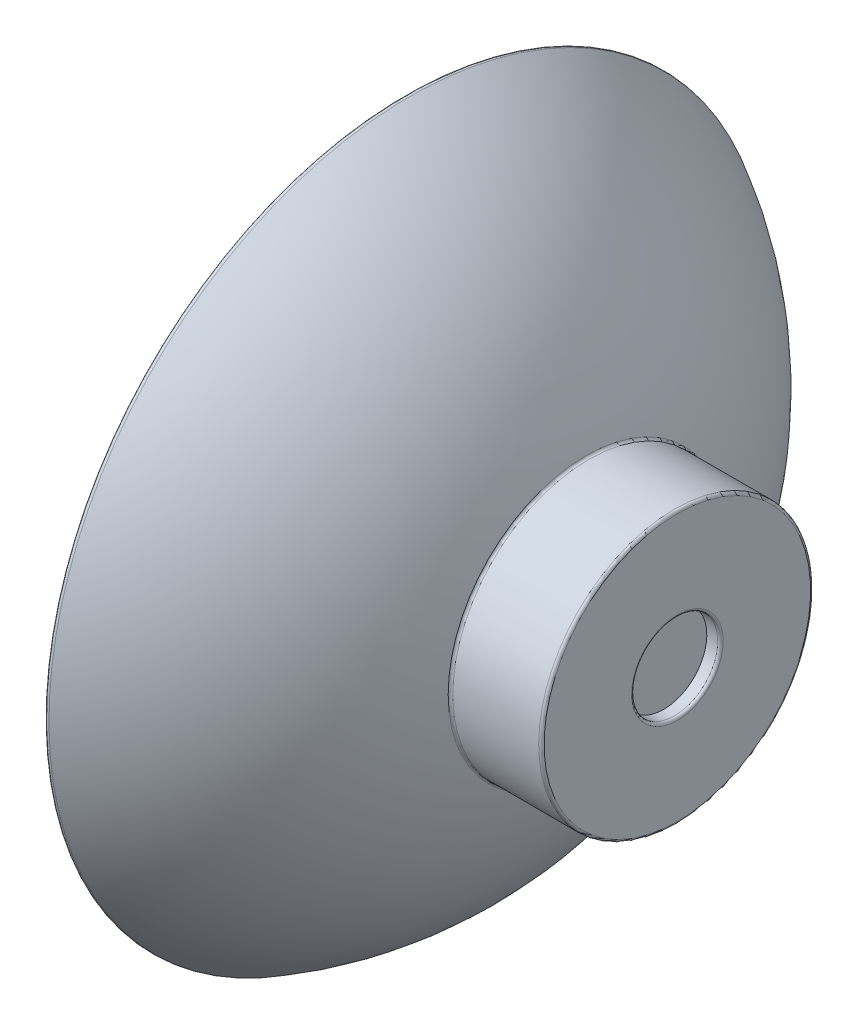
from build123d import *

# Parameters (mm, degrees)
SKETCH2_R          = 2.375
CUT_EXTRUDE2_DEPTH = 0.75
FILLET1_R          = 0.15
FILLET2_R          = 0.15


with BuildPart() as part:
    # Sketch1 → Revolve3 (revolve)
    with BuildSketch(Plane.XY):
        with BuildLine():
            ThreePointArc((-10, 18.822019344), (-3.426328164, 12.472721845), (0, 4))
            Line((0, 4), (0, 7.5))
            ThreePointArc((0, 7.5), (-3.694854211, 14.794116631), (-10, 20))
            Line((-10, 20), (-10, 18.822019344))
        make_face()
        Polygon((0, 4), (0, 0), (2, 0), (2, 4.75), (4, 4.75), (4, 0), (5, 0), (5, 7.5), (0, 7.5), align=None)
    revolve(axis=Axis((0, 0, 0), (-1, 0, 0)))

    # Sketch2 → Cut-Extrude2 (cut)
    with BuildSketch(Plane(origin=(5, 0, 0), x_dir=(0, 0, -1), z_dir=(1, 0, 0))):
        with Locations(Location((0, 0, 0), (0, 0, 90))):
            Circle(SKETCH2_R)
    extrude(amount=-CUT_EXTRUDE2_DEPTH, mode=Mode.SUBTRACT)

    # Fillet1
    fillet1_edges = [part.edges().sort_by_distance(p)[0] for p in [
        (0, -7.5, 0),
        (5, -7.5, 0),
        (0, -4, 0),
        (-10, -18.822019344, 0),
    ]]
    fillet(fillet1_edges, radius=FILLET1_R)

    # Fillet2
    fillet2_edges = [part.edges().sort_by_distance(p)[0] for p in [
        (-10, -20, 0),
        (5, -2.375, 0),
    ]]
    fillet(fillet2_edges, radius=FILLET2_R)


solid = part.part
